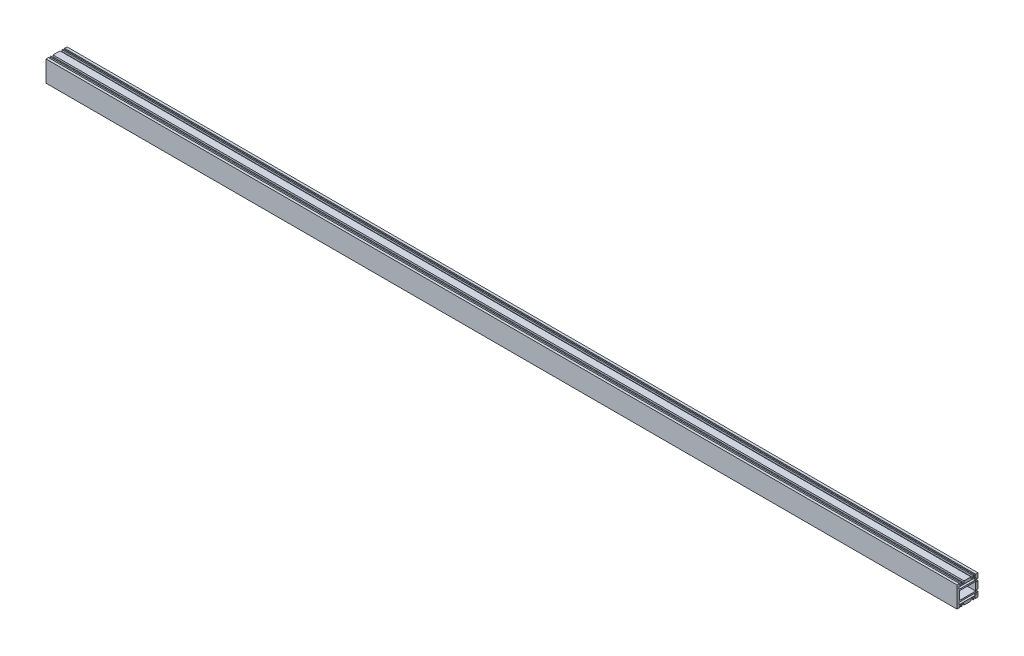
from build123d import *

# Parameters (mm, degrees)
SKETCH_1_W             = 23.5
SKETCH_1_H             = 12
EXTRUDE_1_DEPTH        = 650.5
HOLE_WIZARD_M6_1_D     = 5
HOLE_WIZARD_M6_1_DEPTH = 19
HOLE_WIZARD_M6_1_TIP   = 1.502151548
HOLE_WIZARD_M6_2_D     = 5
HOLE_WIZARD_M6_2_DEPTH = 19
HOLE_WIZARD_M6_2_TIP   = 1.502151548
HOLE_WIZARD_M4_1_D     = 3.3
HOLE_WIZARD_M4_1_DEPTH = 15
HOLE_WIZARD_M4_1_TIP   = 0.991420021


with BuildPart() as part:
    # 草图1 → 凸台-拉伸1 (new, symmetric)
    with BuildSketch(Plane(origin=(0, 0, 0), x_dir=(0, 0, -1), z_dir=(1, 0, 0))):
        Polygon((-15, 15), (-11.5, 15), (-11.5, 13.5), (-11, 13.5), (-11, 12), (-9.5, 12), (-9.5, 15), (-8, 15), (-8, 12.5), (-5, 12.5), (-5, 15), (5, 15), (5, 12.5), (8, 12.5), (8, 15), (9.5, 15), (9.5, 12), (11, 12), (11, 13.5), (11.5, 13.5), (11.5, 15), (15, 15), (15, 8), (12.5, 8), (12.5, 5), (15, 5), (15, -5), (12.5, -5), (12.5, -8), (15, -8), (15, -15), (11.5, -15), (11.5, -13.5), (11, -13.5), (11, -12), (9.5, -12), (9.5, -15), (8, -15), (8, -12.5), (5, -12.5), (5, -15), (-5, -15), (-5, -12.5), (-8, -12.5), (-8, -15), (-9.5, -15), (-9.5, -12), (-11, -12), (-11, -13.5), (-11.5, -13.5), (-11.5, -15), (-15, -15), align=None)
        with BuildLine():
            Line((12, -10.5), (12, -8.5))
            ThreePointArc((12, -8.5), (11.853553391, -8.146446609), (11.5, -8))
            Line((11.5, -8), (-11.5, -8))
            ThreePointArc((-11.5, -8), (-11.853553391, -8.146446609), (-12, -8.5))
            Line((-12, -8.5), (-12, -10.5))
            ThreePointArc((-12, -10.5), (-11.853553391, -10.853553391), (-11.5, -11))
            Line((-11.5, -11), (11.5, -11))
            ThreePointArc((11.5, -11), (11.853553391, -10.853553391), (12, -10.5))
        make_face(mode=Mode.SUBTRACT)
        with BuildLine():
            Line((-11.5, 11), (11.5, 11))
            ThreePointArc((11.5, 11), (11.853553391, 10.853553391), (12, 10.5))
            Line((12, 10.5), (12, 8.5))
            ThreePointArc((12, 8.5), (11.853553391, 8.146446609), (11.5, 8))
            Line((11.5, 8), (-11.5, 8))
            ThreePointArc((-11.5, 8), (-11.853553391, 8.146446609), (-12, 8.5))
            Line((-12, 8.5), (-12, 10.5))
            ThreePointArc((-12, 10.5), (-11.853553391, 10.853553391), (-11.5, 11))
        make_face(mode=Mode.SUBTRACT)
        Rectangle(SKETCH_1_W, SKETCH_1_H, mode=Mode.SUBTRACT)
    extrude(amount=EXTRUDE_1_DEPTH, both=True)

    # M6 螺纹孔1
    with Locations(Plane(origin=(0, -15, 0), x_dir=(-1, 0, 0), z_dir=(0, -1, 0))):
        with Locations((615.5, 0), (630.5, 0), (-615.5, 0), (-630.5, 0)):
            Hole(HOLE_WIZARD_M6_1_D / 2, depth=HOLE_WIZARD_M6_1_DEPTH)
            with Locations((0, 0, -(HOLE_WIZARD_M6_1_DEPTH + HOLE_WIZARD_M6_1_TIP / 2))):  # 118° drill point
                Cone(0, HOLE_WIZARD_M6_1_D / 2, HOLE_WIZARD_M6_1_TIP, mode=Mode.SUBTRACT)

    # M6 螺纹孔2
    with Locations(Plane(origin=(0, 0, -15), x_dir=(-1, 0, 0), z_dir=(0, 0, -1))):
        with Locations((-630.5, 0), (-615.5, 0), (630.5, 0), (615.5, 0)):
            Hole(HOLE_WIZARD_M6_2_D / 2, depth=HOLE_WIZARD_M6_2_DEPTH)
            with Locations((0, 0, -(HOLE_WIZARD_M6_2_DEPTH + HOLE_WIZARD_M6_2_TIP / 2))):  # 118° drill point
                Cone(0, HOLE_WIZARD_M6_2_D / 2, HOLE_WIZARD_M6_2_TIP, mode=Mode.SUBTRACT)

    # M4 螺纹孔1
    with Locations(Plane(origin=(0, 0, -15), x_dir=(-1, 0, 0), z_dir=(0, 0, -1))):
        with Locations((560, 0), (280, 0), (0, 0), (-280, 0), (-560, 0)):
            Hole(HOLE_WIZARD_M4_1_D / 2, depth=HOLE_WIZARD_M4_1_DEPTH)
            with Locations((0, 0, -(HOLE_WIZARD_M4_1_DEPTH + HOLE_WIZARD_M4_1_TIP / 2))):  # 118° drill point
                Cone(0, HOLE_WIZARD_M4_1_D / 2, HOLE_WIZARD_M4_1_TIP, mode=Mode.SUBTRACT)


solid = part.part
